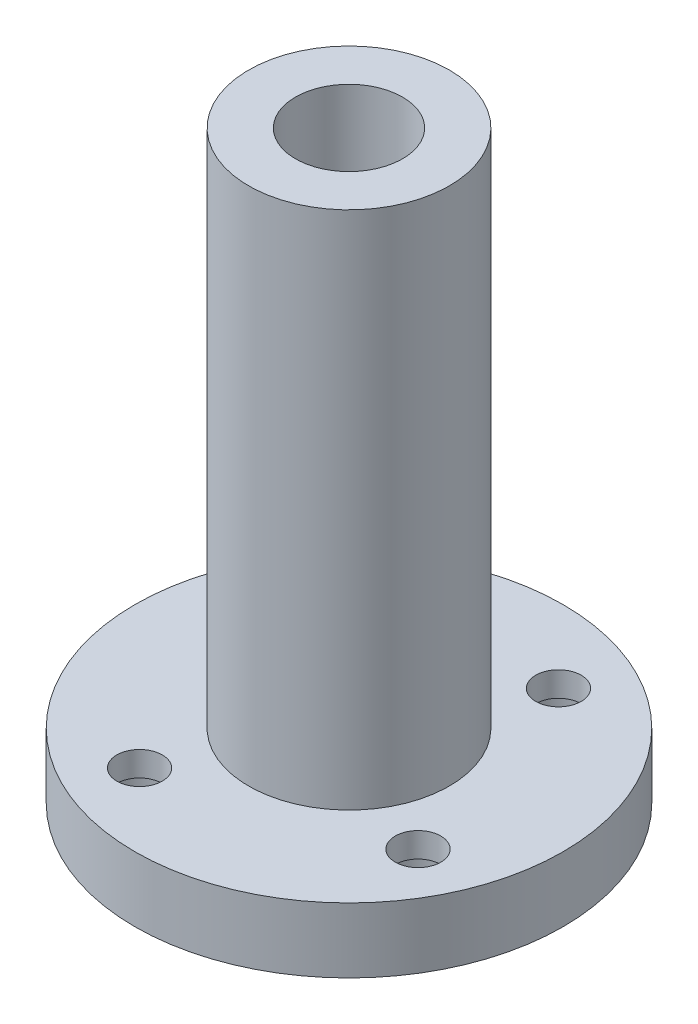
from build123d import *

# Parameters (mm, degrees)
SKETCH_1_R          = 16.47426238
SKETCH_1_R_2        = 1.75
SKETCH_1_R_3        = 7.722310491
EXTRUDE_1_DEPTH     = 5
SKETCH_1_3_R        = 7.722310491
SKETCH_1_3_R_2      = 4.118565595
EXTRUDE_2_DEPTH     = 45
SKETCH_2_R          = 3
CUT_EXTRUDE_1_DEPTH = 3.1


with BuildPart() as part:
    # 草图1 → 凸台-拉伸1 (new body)
    with BuildSketch(Plane(origin=(0, 0, 0), x_dir=(1, 0, 0), z_dir=(0, 1, 0))):
        Circle(SKETCH_1_R)
        with Locations((-5.402922146, -10.714869681)):
            Circle(SKETCH_1_R_2, mode=Mode.SUBTRACT)
        with Locations((10.714869681, -5.402922146)):
            Circle(SKETCH_1_R_2, mode=Mode.SUBTRACT)
        with Locations((-10.714869681, 5.402922146)):
            Circle(SKETCH_1_R_2, mode=Mode.SUBTRACT)
        Circle(SKETCH_1_R_3, mode=Mode.SUBTRACT)
        with Locations((5.402922146, 10.714869681)):
            Circle(SKETCH_1_R_2, mode=Mode.SUBTRACT)
    extrude(amount=EXTRUDE_1_DEPTH)

    # 草图1<3> → 凸台-拉伸2 (add)
    with BuildSketch(Plane(origin=(0, 0, 0), x_dir=(1, 0, 0), z_dir=(0, 1, 0))):
        Circle(SKETCH_1_3_R)
        Circle(SKETCH_1_3_R_2, mode=Mode.SUBTRACT)
    extrude(amount=EXTRUDE_2_DEPTH)

    # 草图2 → 切除-拉伸1 (cut)
    with BuildSketch(Plane.XZ):
        with Locations((5.402922146, -10.714869681)):
            Circle(SKETCH_2_R)
        with Locations((-10.714869681, -5.402922146)):
            Circle(SKETCH_2_R)
        with Locations((-5.402922146, 10.714869681)):
            Circle(SKETCH_2_R)
        with Locations((10.714869681, 5.402922146)):
            Circle(SKETCH_2_R)
    extrude(amount=-CUT_EXTRUDE_1_DEPTH, mode=Mode.SUBTRACT)


solid = part.part
